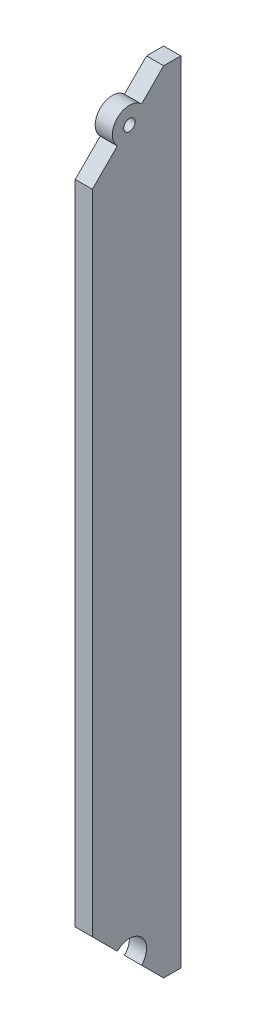
from build123d import *

# Parameters (mm, degrees)
BOSS_EXTRUDE1_DEPTH = 6
SKETCH4_R           = 6
BOSS_EXTRUDE2_DEPTH = 6
SKETCH3_R           = 2
SKETCH3_R_2         = 6
CUT_EXTRUDE1_DEPTH  = 279.190582155


with BuildPart() as part:
    # Sketch2 → Boss-Extrude1 (new body)
    with BuildSketch(Plane(origin=(0, 0, 0), x_dir=(0, 0, -1), z_dir=(1, 0, 0))):
        Polygon((0, 277), (6, 277), (6, 0), (0, 0), (-25, 25), (-25, 252), align=None)
    extrude(amount=BOSS_EXTRUDE1_DEPTH)

    # Sketch4 → Boss-Extrude2 (add)
    with BuildSketch(Plane(origin=(6, 0, 0), x_dir=(0, 0, -1), z_dir=(1, 0, 0))):
        with Locations((-12, 265)):
            Circle(SKETCH4_R)
    extrude(amount=-BOSS_EXTRUDE2_DEPTH)

    # Sketch3 → Cut-Extrude1 (cut, through all)
    with BuildSketch(Plane(origin=(6, 0, 0), x_dir=(0, 0, -1), z_dir=(1, 0, 0))):
        with Locations((-12, 265)):
            Circle(SKETCH3_R)
        with Locations((-12, 12)):
            Circle(SKETCH3_R_2)
    extrude(amount=-CUT_EXTRUDE1_DEPTH, mode=Mode.SUBTRACT)


solid = part.part
